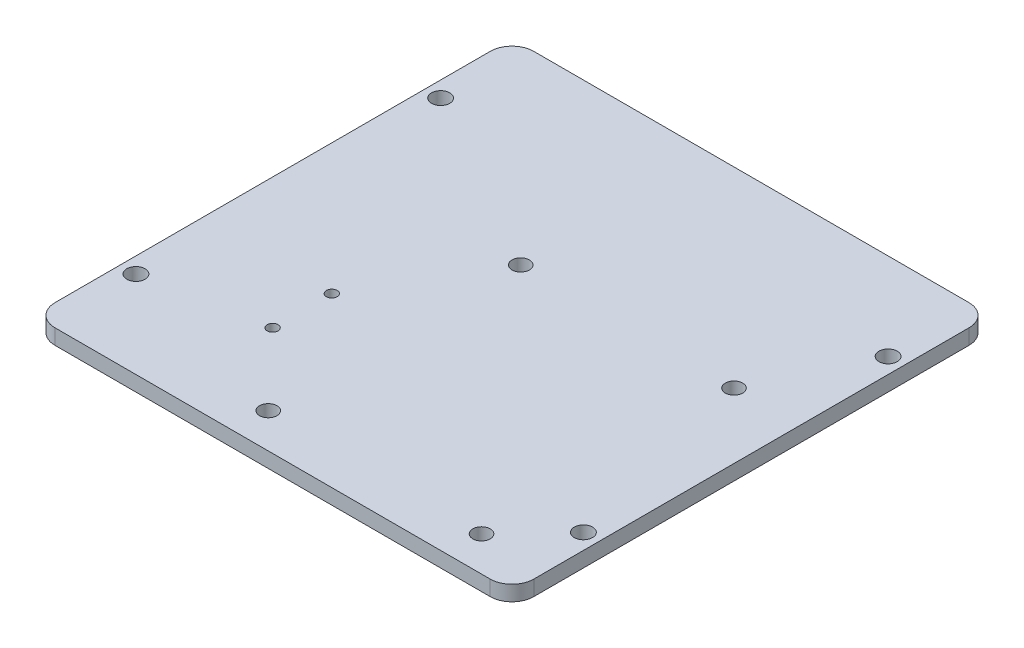
from build123d import *

# Parameters (mm, degrees)
ESQUISSE1_R        = 2.1
BOSS_EXTRU_1_DEPTH = 3.5
CONG_1_R           = 5
ESQUISSE3_R        = 2
TROUS_RPI_DEPTH    = 78.860452092
ESQUISSE5_R        = 1.25
TROUS_ICM_DEPTH    = 78.860452092


with BuildPart() as part:
    # Esquisse1 → Boss.-Extru.1 (new body)
    # profile 1 of 2: a face of its own
    with BuildSketch(Plane(origin=(0, 0, 0), x_dir=(1, 0, 0), z_dir=(0, 1, 0))):
        with BuildLine():
            Line((-55, 31.4), (-55, -55))
            Line((-55, -55), (55, -55))
            Line((55, -55), (55, 55))
            Line((55, 55), (-55, 55))
            Line((-55, 55), (-55, 38.6))
            Line((-55, 38.6), (-51.4, 38.6))
            ThreePointArc((-51.4, 38.6), (-47.8, 35), (-51.4, 31.4))
            Line((-51.4, 31.4), (-55, 31.4))
        make_face()
        with Locations(Location((-51.4, -35, 0), (0, 0, 270))):
            Circle(ESQUISSE1_R, mode=Mode.SUBTRACT)
        with Locations(Location((51.4, -35, 0), (0, 0, 270))):
            Circle(ESQUISSE1_R, mode=Mode.SUBTRACT)
        with Locations(Location((51.4, 35, 0), (0, 0, 270))):
            Circle(ESQUISSE1_R, mode=Mode.SUBTRACT)
    # profile 2 of 2: a face of its own
    with BuildSketch(Plane(origin=(0, 0, 0), x_dir=(1, 0, 0), z_dir=(0, 1, 0))):
        with BuildLine():
            Line((-55, 38.6), (-55, 31.4))
            Line((-55, 31.4), (-51.4, 31.4))
            ThreePointArc((-51.4, 31.4), (-47.8, 35), (-51.4, 38.6))
            Line((-51.4, 38.6), (-55, 38.6))
        make_face()
        with Locations(Location((-51.4, 35, 0), (0, 0, 270))):
            Circle(ESQUISSE1_R, mode=Mode.SUBTRACT)
    extrude(amount=BOSS_EXTRU_1_DEPTH)

    # Congé1
    cong_1_edges = [part.edges().sort_by_distance(p)[0] for p in [
        (55, 1.75, -55),
        (55, 1.75, 55),
        (-55, 1.75, 55),
        (-55, 1.75, -55),
    ]]
    fillet(cong_1_edges, radius=CONG_1_R)

    # Esquisse3 → Trous RPI (cut, through all)
    with BuildSketch(Plane(origin=(0, 3.5, 0), x_dir=(1, 0, 0), z_dir=(0, 1, 0))):
        with Locations(Location((40, 11, 0), (0, 0, 270))):
            Circle(ESQUISSE3_R)
        with Locations(Location((40, -47, 0), (0, 0, 270))):
            Circle(ESQUISSE3_R)
        with Locations(Location((-9, -47, 0), (0, 0, 270))):
            Circle(ESQUISSE3_R)
        with Locations(Location((-9, 11, 0), (0, 0, 270))):
            Circle(ESQUISSE3_R)
    extrude(amount=-TROUS_RPI_DEPTH, mode=Mode.SUBTRACT)

    # Esquisse5 → Trous ICM (cut, through all)
    with BuildSketch(Plane(origin=(0, 0, 0), x_dir=(-1, 0, 0), z_dir=(0, -1, 0))):
        with Locations(Location((25, -30, 0), (0, 0, 90))):
            Circle(ESQUISSE5_R)
        with Locations(Location((25, -16.4, 0), (0, 0, 90))):
            Circle(ESQUISSE5_R)
    extrude(amount=-TROUS_ICM_DEPTH, mode=Mode.SUBTRACT)


solid = part.part
